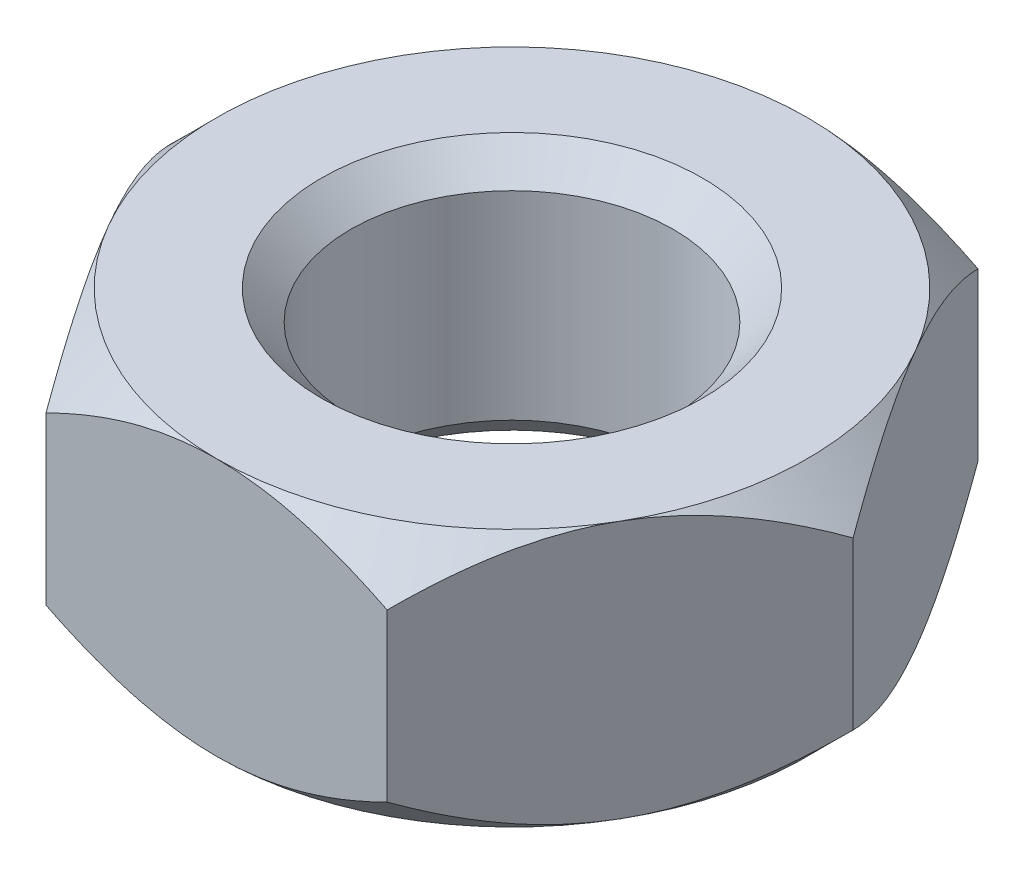
from build123d import *

# Parameters (mm, degrees)
SKETCH1_R           = 1.5
BOSS_EXTRUDE1_DEPTH = 2.4
CHAMFER1_SIZE       = 0.275


with BuildPart() as part:
    # Sketch1 → Boss-Extrude1 (new body)
    with BuildSketch(Plane(origin=(0, 0, 0), x_dir=(1, 0, 0), z_dir=(0, 1, 0))):
        Polygon((3.175426481, 0), (1.58771324, 2.75), (-1.58771324, 2.75), (-3.175426481, 0), (-1.58771324, -2.75), (1.58771324, -2.75), align=None)
        with Locations(Location((0, 0, 0), (0, 0, 270))):
            Circle(SKETCH1_R, mode=Mode.SUBTRACT)
    extrude(amount=BOSS_EXTRUDE1_DEPTH)

    # Sketch3 → Cut-Revolve1 (revolve, cut)
    with BuildSketch(Plane(origin=(0, 0, 0), x_dir=(0, 0, -1), z_dir=(1, 0, 0))):
        Polygon((-2.75, 0), (-3.45, 0.7), (-3.45, 0), align=None)
        Polygon((-3.45, 2.4), (-2.75, 2.4), (-3.45, 1.7), align=None)
    revolve(axis=Axis((0, 0, 0), (0, 1, 0)), mode=Mode.SUBTRACT)

    # Chamfer1
    chamfer1_edges = [part.edges().sort_by_distance(p)[0] for p in [
        (0, 0, -1.5),
        (0, 2.4, -1.5),
    ]]
    chamfer(chamfer1_edges, length=CHAMFER1_SIZE)


solid = part.part
